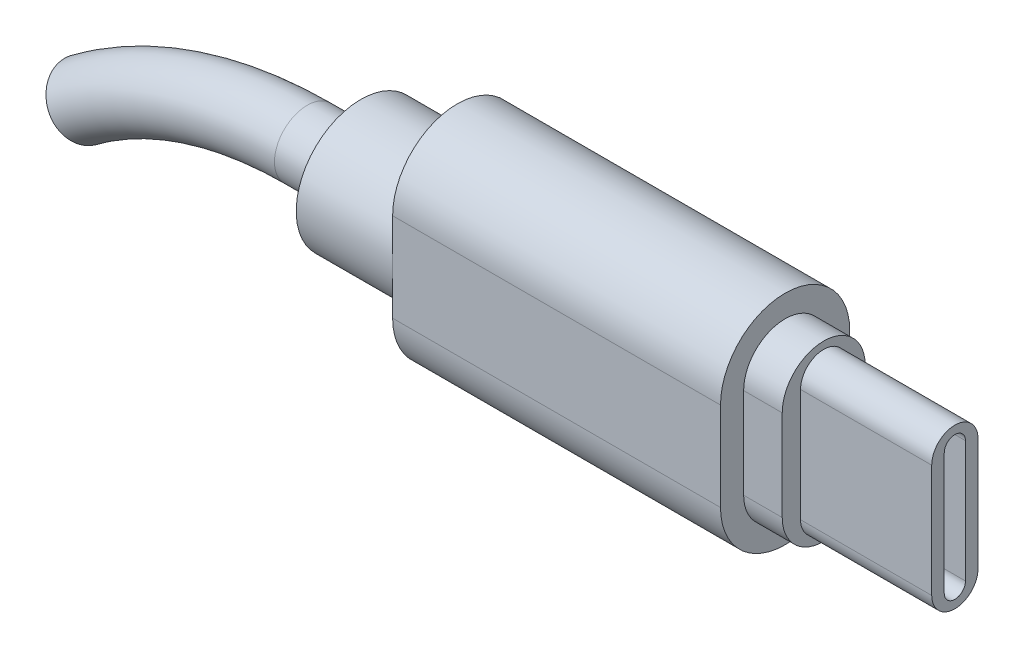
from build123d import *

# Parameters (mm, degrees)
EXTRUDE_1_DEPTH     = 17
EXTRUDE_2_DEPTH     = 2
SKETCH_4_R          = 3.35
EXTRUDE_3_DEPTH     = 5
SKETCH_5_R          = 1.7
EXTRUDE_4_DEPTH     = 6.8
CUT_EXTRUDE_1_DEPTH = 5


with BuildPart() as part:
    # Эскиз1 → Бобышка-Вытянуть1 (new body)
    with BuildSketch(Plane(origin=(0, 0, 0), x_dir=(0, 0, -1), z_dir=(1, 0, 0))):
        with BuildLine():
            Line((-3.35, -2.3), (-3.35, 2.3))
            ThreePointArc((-3.35, 2.3), (0, 5.65), (3.35, 2.3))
            Line((3.35, 2.3), (3.35, -2.3))
            ThreePointArc((3.35, -2.3), (0, -5.65), (-3.35, -2.3))
        make_face()
    extrude(amount=-EXTRUDE_1_DEPTH)

    # Эскиз3 → Бобышка-Вытянуть2 (add)
    with BuildSketch(Plane.ZY):
        with BuildLine():
            Line((2.15, 2.35), (2.15, -2.35))
            ThreePointArc((2.15, -2.35), (0, -4.5), (-2.15, -2.35))
            Line((-2.15, -2.35), (-2.15, 2.35))
            ThreePointArc((-2.15, 2.35), (0, 4.5), (2.15, 2.35))
        make_face()
    extrude(amount=-EXTRUDE_2_DEPTH)

    # Эскиз4 → Бобышка-Вытянуть3 (add)
    with BuildSketch(Plane(origin=(-17, 0, 0), x_dir=(0, 0, -1), z_dir=(1, 0, 0))):
        Circle(SKETCH_4_R)
    extrude(amount=-EXTRUDE_3_DEPTH)

    # По траектории1: sweep along a path in Эскиз6
    with BuildLine(Plane.XY) as sweep_1_path:
        Line((-22, 0), (-24.776161806, 0))
        ThreePointArc((-24.776161806, 0), (-30.870449905, -0.986593903), (-36.342181829, -3.845591055))
    # Эскиз5 → По траектории1 (sweep)
    with BuildSketch(Plane.ZY.offset(22)):
        Circle(SKETCH_5_R)
    sweep(path=sweep_1_path.line)

    # Эскиз7 → Бобышка-Вытянуть4 (add)
    with BuildSketch(Plane(origin=(2, 0, 0), x_dir=(0, 0, -1), z_dir=(1, 0, 0))):
        with BuildLine():
            Line((-1.2, -2.925), (-1.2, 2.925))
            ThreePointArc((-1.2, 2.925), (0, 4.125), (1.2, 2.925))
            Line((1.2, 2.925), (1.2, -2.925))
            ThreePointArc((1.2, -2.925), (0, -4.125), (-1.2, -2.925))
        make_face()
    extrude(amount=EXTRUDE_4_DEPTH)

    # Эскиз8 → Вырез-Вытянуть1 (cut)
    with BuildSketch(Plane(origin=(8.8, 0, -8.8), x_dir=(0, 0, 1), z_dir=(-1, 0, 0))):
        with BuildLine():
            Line((8.25, -3.15), (8.25, 3.15))
            ThreePointArc((8.25, 3.15), (8.8, 3.7), (9.35, 3.15))
            Line((9.35, 3.15), (9.35, -3.15))
            ThreePointArc((9.35, -3.15), (8.8, -3.7), (8.25, -3.15))
        make_face()
    extrude(amount=CUT_EXTRUDE_1_DEPTH, mode=Mode.SUBTRACT)


solid = part.part
